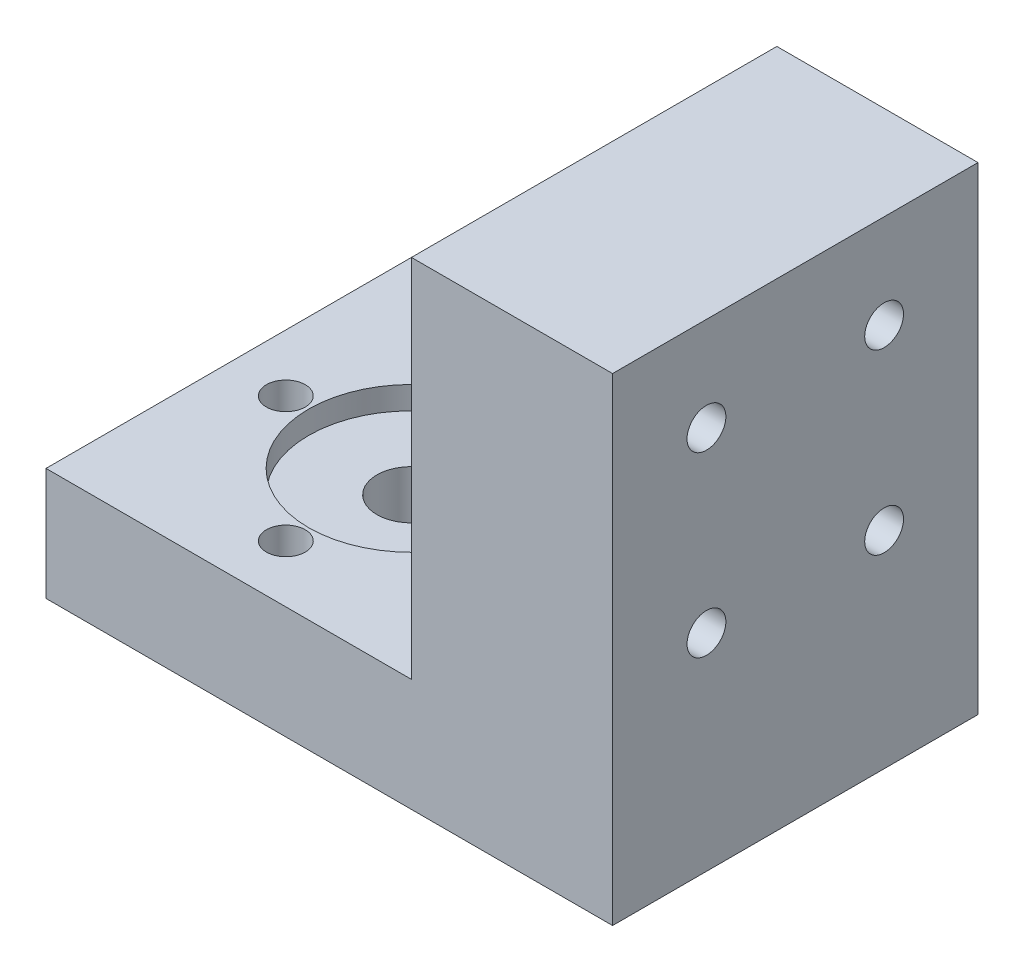
from build123d import *

# Parameters (mm, degrees)
SKETCH1_W           = 32
SKETCH1_H           = 32
SKETCH1_R           = 1.7
SKETCH1_R_2         = 3.02
BOSS_EXTRUDE1_DEPTH = 9.864848297
SKETCH1_5_R         = 9
CUT_EXTRUDE2_DEPTH  = 2
SKETCH7_W           = 32
SKETCH7_H           = 9.864848297
BOSS_EXTRUDE3_DEPTH = 17.613942208
SKETCH10_W          = 17.613942208
SKETCH10_H          = 32
BOSS_EXTRUDE5_DEPTH = 32
SKETCH11_R          = 1.7
CUT_EXTRUDE3_DEPTH  = 49


with BuildPart() as part:
    # Sketch1 → Boss-Extrude1 (new body)
    with BuildSketch(Plane(origin=(0, 0, 0), x_dir=(1, 0, 0), z_dir=(0, 1, 0))):
        Rectangle(SKETCH1_W, SKETCH1_H)
        with Locations((0, 11)):
            Circle(SKETCH1_R, mode=Mode.SUBTRACT)
        with Locations((-11, 0)):
            Circle(SKETCH1_R, mode=Mode.SUBTRACT)
        with Locations((0, -11)):
            Circle(SKETCH1_R, mode=Mode.SUBTRACT)
        with Locations((11, 0)):
            Circle(SKETCH1_R, mode=Mode.SUBTRACT)
        Circle(SKETCH1_R_2, mode=Mode.SUBTRACT)
    extrude(amount=-BOSS_EXTRUDE1_DEPTH)

    # Sketch1<5> → Cut-Extrude2 (cut)
    with BuildSketch(Plane(origin=(0, 0, 0), x_dir=(1, 0, 0), z_dir=(0, 1, 0))):
        Circle(SKETCH1_5_R)
    extrude(amount=-CUT_EXTRUDE2_DEPTH, mode=Mode.SUBTRACT)

    # Sketch7 → Boss-Extrude3 (add)
    with BuildSketch(Plane(origin=(16, 0, 0), x_dir=(0, 0, -1), z_dir=(1, 0, 0))):
        with Locations((0, -4.932424148)):
            Rectangle(SKETCH7_W, SKETCH7_H)
    extrude(amount=BOSS_EXTRUDE3_DEPTH)

    # Sketch10 → Boss-Extrude5 (add)
    with BuildSketch(Plane(origin=(0, 0, 0), x_dir=(1, 0, 0), z_dir=(0, 1, 0))):
        with Locations((24.806971104, 0)):
            Rectangle(SKETCH10_W, SKETCH10_H)
    extrude(amount=BOSS_EXTRUDE5_DEPTH)

    # Sketch11 → Cut-Extrude3 (cut, through all)
    with BuildSketch(Plane.ZY.offset(-16)):
        with Locations((-7.778174593, 23.778174593)):
            Circle(SKETCH11_R)
        with Locations((7.778174593, 23.778174593)):
            Circle(SKETCH11_R)
        with Locations((7.778174593, 8.221825407)):
            Circle(SKETCH11_R)
        with Locations((-7.778174593, 8.221825407)):
            Circle(SKETCH11_R)
    extrude(amount=-CUT_EXTRUDE3_DEPTH, mode=Mode.SUBTRACT)


solid = part.part
